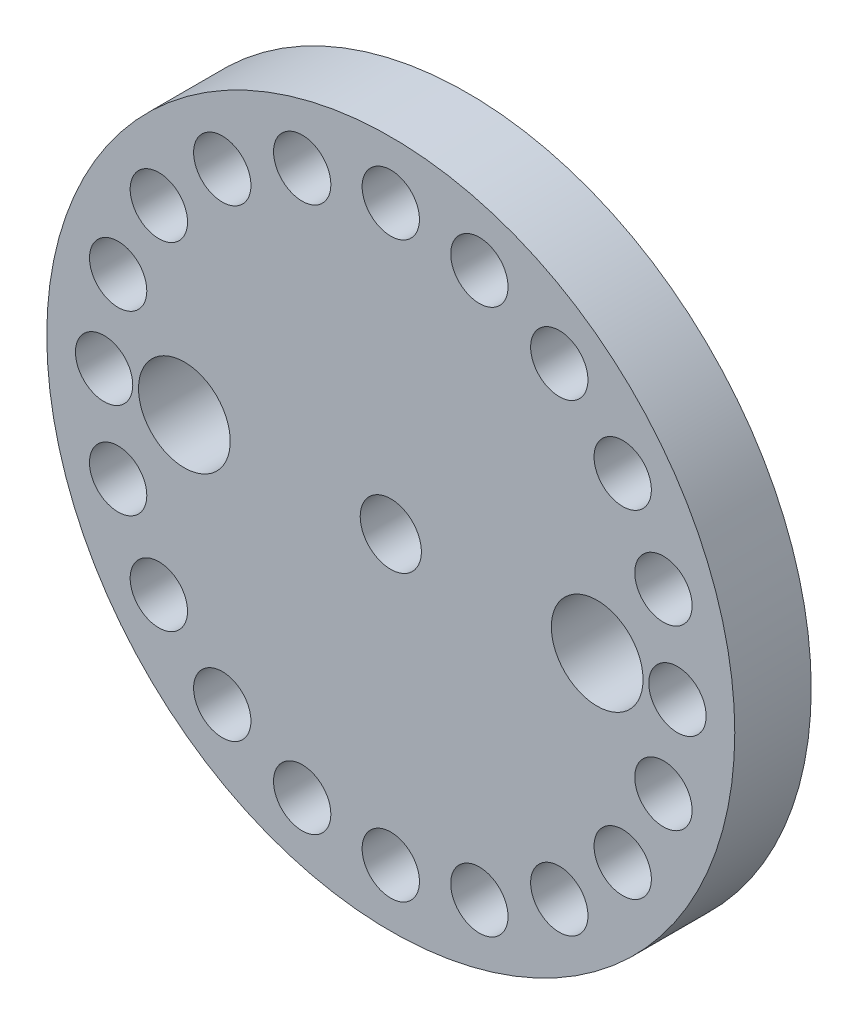
from build123d import *

# Parameters (mm, degrees)
SKETCH1_R           = 45
SKETCH1_R_2         = 3.75
BOSS_EXTRUDE1_DEPTH = 10
SKETCH2_R           = 6
CUT_EXTRUDE1_DEPTH  = 10
SKETCH3_R           = 4
CUT_EXTRUDE2_DEPTH  = 13


with BuildPart() as part:
    # Sketch1 → Boss-Extrude1 (new body)
    with BuildSketch(Plane.XY):
        Circle(SKETCH1_R)
        with Locations((0, 37.5)):
            Circle(SKETCH1_R_2, mode=Mode.SUBTRACT)
        with Locations((11.588137289, 35.664619361)):
            Circle(SKETCH1_R_2, mode=Mode.SUBTRACT)
        with Locations((22.041946961, 30.338137289)):
            Circle(SKETCH1_R_2, mode=Mode.SUBTRACT)
        with Locations((30.338137289, 22.041946961)):
            Circle(SKETCH1_R_2, mode=Mode.SUBTRACT)
        with Locations((35.664619361, 11.588137289)):
            Circle(SKETCH1_R_2, mode=Mode.SUBTRACT)
        with Locations((37.5, 0)):
            Circle(SKETCH1_R_2, mode=Mode.SUBTRACT)
        with Locations((35.664619361, -11.588137289)):
            Circle(SKETCH1_R_2, mode=Mode.SUBTRACT)
        with Locations((30.338137289, -22.041946961)):
            Circle(SKETCH1_R_2, mode=Mode.SUBTRACT)
        with Locations((22.041946961, -30.338137289)):
            Circle(SKETCH1_R_2, mode=Mode.SUBTRACT)
        with Locations((11.588137289, -35.664619361)):
            Circle(SKETCH1_R_2, mode=Mode.SUBTRACT)
        with Locations((0, -37.5)):
            Circle(SKETCH1_R_2, mode=Mode.SUBTRACT)
        with Locations((-11.588137289, -35.664619361)):
            Circle(SKETCH1_R_2, mode=Mode.SUBTRACT)
        with Locations((-22.041946961, -30.338137289)):
            Circle(SKETCH1_R_2, mode=Mode.SUBTRACT)
        with Locations((-30.338137289, -22.041946961)):
            Circle(SKETCH1_R_2, mode=Mode.SUBTRACT)
        with Locations((-35.664619361, -11.588137289)):
            Circle(SKETCH1_R_2, mode=Mode.SUBTRACT)
        with Locations((-37.5, 0)):
            Circle(SKETCH1_R_2, mode=Mode.SUBTRACT)
        with Locations((-35.664619361, 11.588137289)):
            Circle(SKETCH1_R_2, mode=Mode.SUBTRACT)
        with Locations((-30.338137289, 22.041946961)):
            Circle(SKETCH1_R_2, mode=Mode.SUBTRACT)
        with Locations((-22.041946961, 30.338137289)):
            Circle(SKETCH1_R_2, mode=Mode.SUBTRACT)
        with Locations((-11.588137289, 35.664619361)):
            Circle(SKETCH1_R_2, mode=Mode.SUBTRACT)
    extrude(amount=BOSS_EXTRUDE1_DEPTH)

    # Sketch2 → Cut-Extrude1 (cut)
    with BuildSketch(Plane(origin=(0, 0, 0), x_dir=(-1, 0, 0), z_dir=(0, 0, -1))):
        with Locations((27, 0)):
            Circle(SKETCH2_R)
        with Locations(Location((-27, 0, 0), (0, 0, 180))):
            Circle(SKETCH2_R)
    extrude(amount=-CUT_EXTRUDE1_DEPTH, mode=Mode.SUBTRACT)

    # Sketch3 → Cut-Extrude2 (cut)
    with BuildSketch(Plane(origin=(0, 0, 0), x_dir=(-1, 0, 0), z_dir=(0, 0, -1))):
        Circle(SKETCH3_R)
    extrude(amount=-CUT_EXTRUDE2_DEPTH, mode=Mode.SUBTRACT)


solid = part.part
